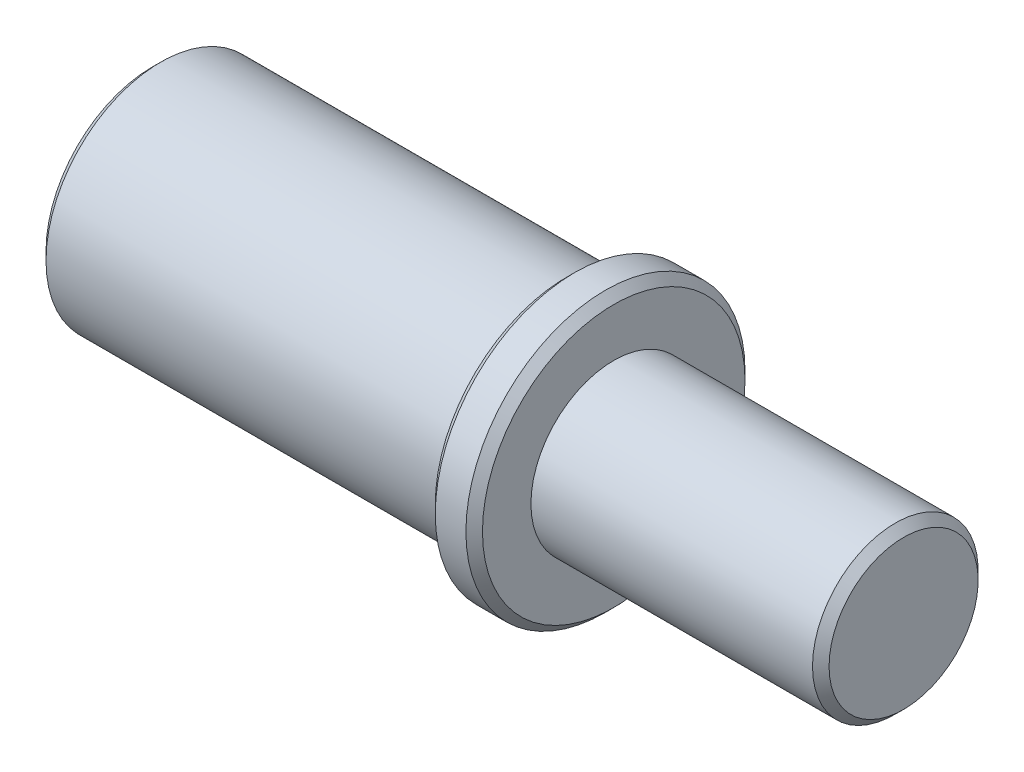
from build123d import *

# Parameters (mm, degrees)
CHAMFER_1_SIZE = 1


with BuildPart() as part:
    # Эскиз1 → Повернуть1 (revolve)
    with BuildSketch(Plane.XY, mode=Mode.PRIVATE) as revolve_1_sk:
        Polygon((0, 0), (0, 13.85), (50, 13.85), (50, 16.85), (55.7, 16.85), (55.7, 10), (90.7, 10), (90.7, 0), align=None)
    revolve(revolve_1_sk.sketch.rotate(Axis((0, 0, 0), (1, 0, 0)), 90), axis=Axis((0, 0, 0), (1, 0, 0)))

    # Фаска1
    chamfer_1_edges = [part.edges().sort_by_distance(p)[0] for p in [
        (90.7, 0, -10),
        (55.7, 0, -16.85),
        (50, 0, -16.85),
        (0, 0, -13.85),
    ]]
    chamfer(chamfer_1_edges, length=CHAMFER_1_SIZE)


solid = part.part
